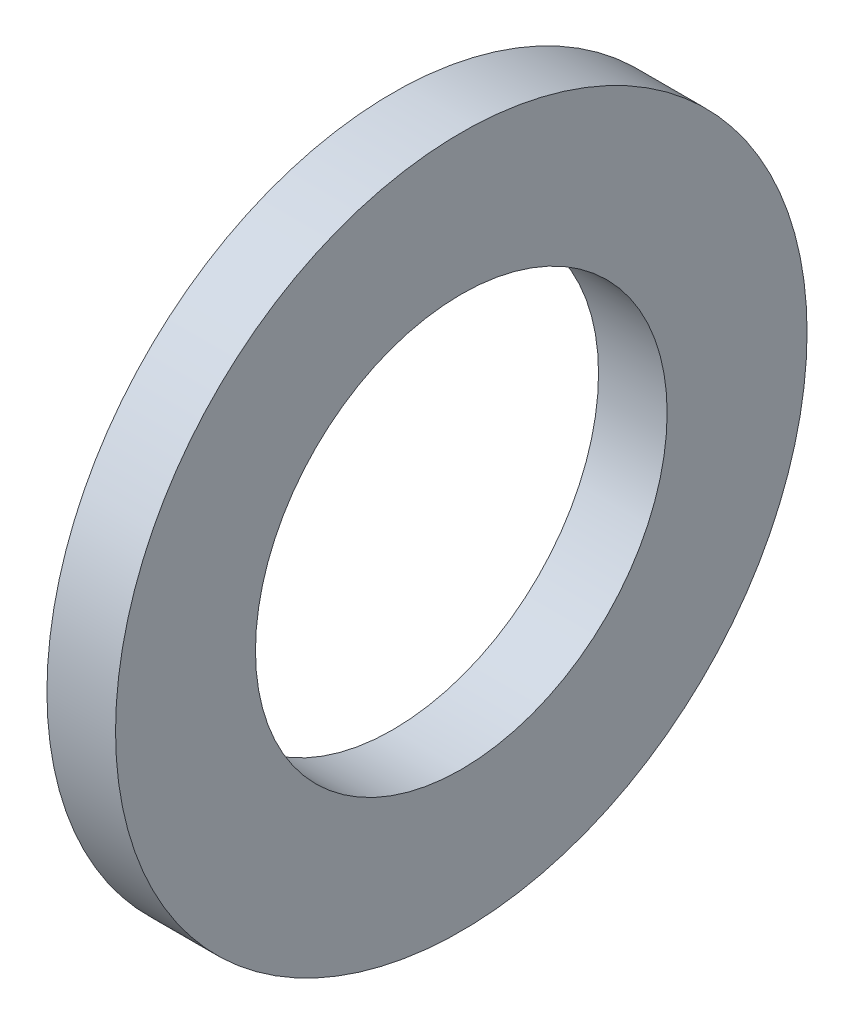
from build123d import *

# Parameters (mm, degrees)
SKETCH1_R           = 4
SKETCH1_R_2         = 2.38125
BOSS_EXTRUDE1_DEPTH = 0.79375


with BuildPart() as part:
    # Sketch1 → Boss-Extrude1 (new body)
    with BuildSketch(Plane(origin=(0, 0, 0), x_dir=(0, 0, -1), z_dir=(1, 0, 0))):
        Circle(SKETCH1_R)
        Circle(SKETCH1_R_2, mode=Mode.SUBTRACT)
    extrude(amount=BOSS_EXTRUDE1_DEPTH)


solid = part.part
